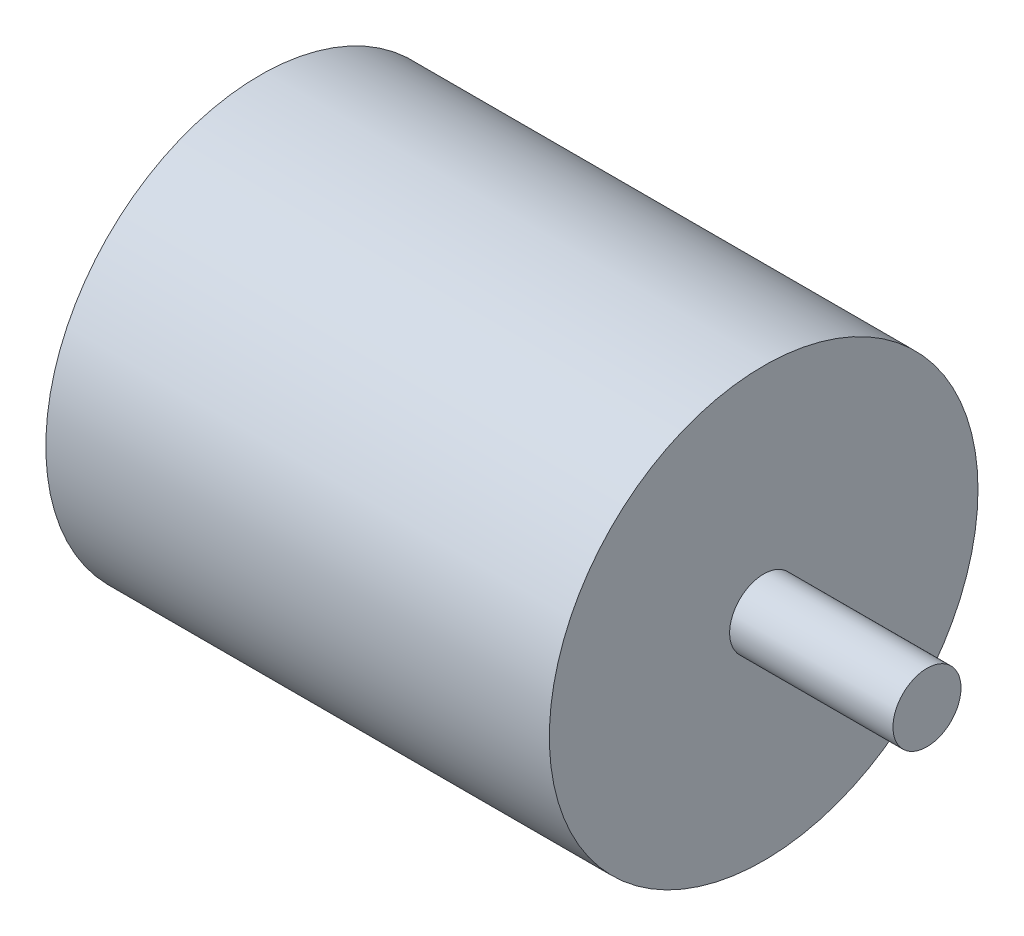
from build123d import *

# Parameters (mm, degrees)
SKETCH1_R           = 31.5
BOSS_EXTRUDE1_DEPTH = 74
SKETCH4_R           = 5
BOSS_EXTRUDE3_DEPTH = 24


with BuildPart() as part:
    # Sketch1 → Boss-Extrude1 (new body)
    with BuildSketch(Plane(origin=(0, 0, 0), x_dir=(0, 0, -1), z_dir=(1, 0, 0))):
        Circle(SKETCH1_R)
    extrude(amount=BOSS_EXTRUDE1_DEPTH)

    # Sketch4 → Boss-Extrude3 (add)
    with BuildSketch(Plane(origin=(74, 0, 0), x_dir=(0, 0, -1), z_dir=(1, 0, 0))):
        Circle(SKETCH4_R)
    extrude(amount=BOSS_EXTRUDE3_DEPTH)


solid = part.part
